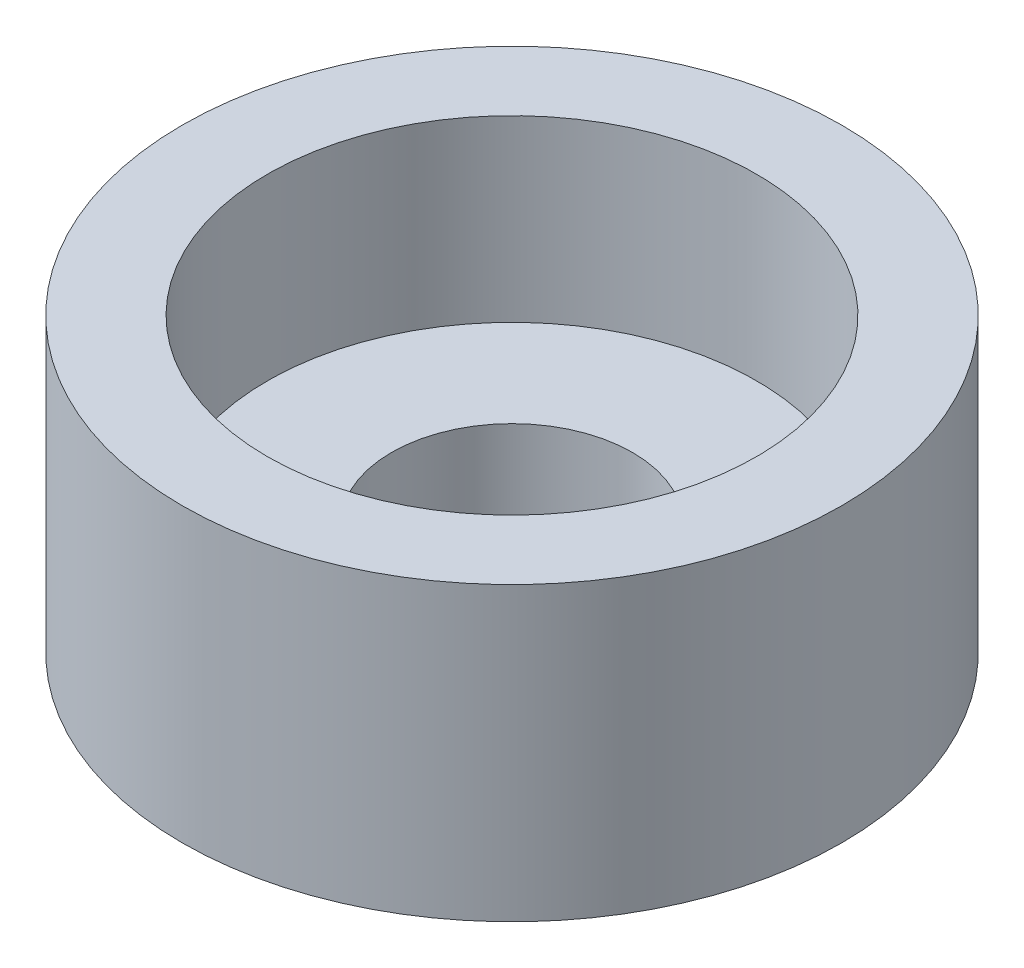
from build123d import *

# Parameters (mm, degrees)
SKETCH1_R           = 35
SKETCH1_R_2         = 12.8
BOSS_EXTRUDE1_DEPTH = 31
SKETCH4_R           = 25.97
CUT_EXTRUDE3_DEPTH  = 19
SKETCH10_R          = 2.125
CUT_EXTRUDE6_DEPTH  = 5.1


with BuildPart() as part:
    # Sketch1 → Boss-Extrude1 (new body)
    with BuildSketch(Plane(origin=(0, 0, 0), x_dir=(1, 0, 0), z_dir=(0, 1, 0))):
        with Locations(Location((0, 0, 0), (0, 0, 270))):
            Circle(SKETCH1_R)
        with Locations(Location((0, 0, 0), (0, 0, 270))):
            Circle(SKETCH1_R_2, mode=Mode.SUBTRACT)
    extrude(amount=BOSS_EXTRUDE1_DEPTH)

    # Sketch4 → Cut-Extrude3 (cut)
    with BuildSketch(Plane(origin=(0, 31, 0), x_dir=(1, 0, 0), z_dir=(0, 1, 0))):
        with Locations(Location((0, 0, 0), (0, 0, 270))):
            Circle(SKETCH4_R)
    extrude(amount=-CUT_EXTRUDE3_DEPTH, mode=Mode.SUBTRACT)

    # Sketch10 → Cut-Extrude6 (cut)
    with BuildSketch(Plane.XZ):
        with Locations(Location((-25.362762045, -1.374882343, 0), (0, 0, 270))):
            Circle(SKETCH10_R)
        with Locations(Location((11.490697986, 22.652237412, 0), (0, 0, 270))):
            Circle(SKETCH10_R)
        with Locations(Location((13.872064059, -21.277355069, 0), (0, 0, 270))):
            Circle(SKETCH10_R)
    extrude(amount=-CUT_EXTRUDE6_DEPTH, mode=Mode.SUBTRACT)


solid = part.part
